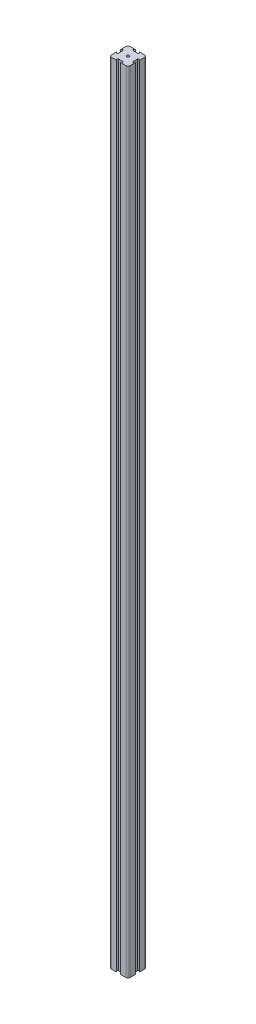
from build123d import *

# Parameters (mm, degrees)
BOSS_EXTRU_2_DEPTH      = 1900
ESQUISSE5_R             = 3
ENL_V_MAT_EXTRU_1_DEPTH = 1901.266428688


with BuildPart() as part:
    # Esquisse4 → Boss.-Extru.2 (new body)
    with BuildSketch(Plane(origin=(0, 0, 0), x_dir=(1, 0, 0), z_dir=(0, 1, 0))):
        with BuildLine():
            Line((-17.5, 22.5), (-5, 22.5))
            ThreePointArc((-5, 22.5), (-7.5, 20), (-5, 17.5))
            Line((-5, 17.5), (5, 17.5))
            ThreePointArc((5, 17.5), (7.5, 20), (5, 22.5))
            Line((5, 22.5), (17.5, 22.5))
            ThreePointArc((17.5, 22.5), (21.035534799, 21.035533013), (22.5, 17.499997475))
            Line((22.5, 17.499997475), (22.5, 4.999997475))
            ThreePointArc((22.5, 4.999997475), (20, 7.499997475), (17.5, 4.999997475))
            Line((17.5, 4.999997475), (17.5, -5.000002525))
            ThreePointArc((17.5, -5.000002525), (20, -7.500002525), (22.5, -5.000002525))
            Line((22.5, -5.000002525), (22.5, -17.500002525))
            ThreePointArc((22.5, -17.500002525), (21.035533013, -21.035534799), (17.5, -22.5))
            Line((17.5, -22.5), (5, -22.5))
            ThreePointArc((5, -22.5), (7.5, -20), (5, -17.5))
            Line((5, -17.5), (-5, -17.5))
            ThreePointArc((-5, -17.5), (-7.5, -20), (-5, -22.5))
            Line((-5, -22.5), (-17.5, -22.5))
            ThreePointArc((-17.5, -22.5), (-21.035533906, -21.035533906), (-22.5, -17.5))
            Line((-22.5, -17.5), (-22.5, -5))
            ThreePointArc((-22.5, -5), (-20, -7.5), (-17.5, -5))
            Line((-17.5, -5), (-17.5, 5))
            ThreePointArc((-17.5, 5), (-20, 7.5), (-22.5, 5))
            Line((-22.5, 5), (-22.5, 17.5))
            ThreePointArc((-22.5, 17.5), (-21.035533906, 21.035533906), (-17.5, 22.5))
        make_face()
    extrude(amount=BOSS_EXTRU_2_DEPTH)

    # Esquisse5 → Enlèv. mat.-Extru.1 (cut, through all)
    with BuildSketch(Plane.XZ):
        with Locations(Location((0, 0, 0), (0, 0, 270))):
            Circle(ESQUISSE5_R)
    extrude(amount=-ENL_V_MAT_EXTRU_1_DEPTH, mode=Mode.SUBTRACT)


solid = part.part
